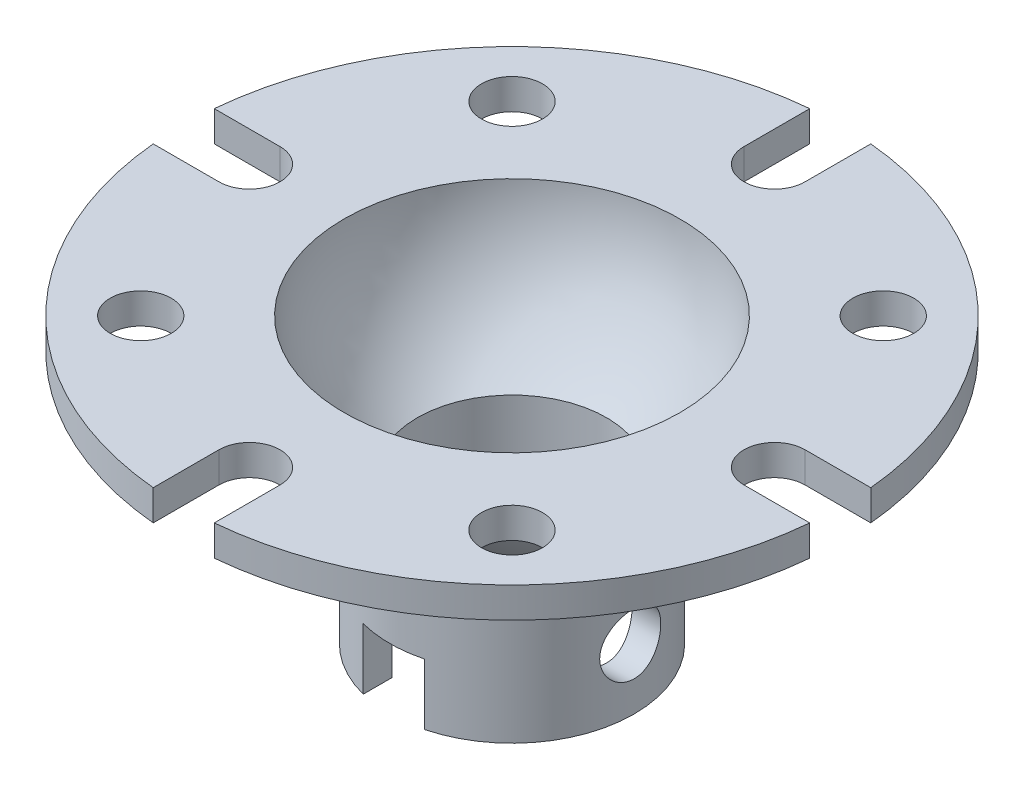
from build123d import *

# Parameters (mm, degrees)
SCHIZZO2_R                           = 10
TAGLIO_ESTRUSIONE2_DEPTH             = 10
RIPETIZIONECIRCOLARE2_COUNT          = 4
TAGLIO_ESTRUSIONE3_REACH             = 180.261
SCHIZZO4_R                           = 10
TAGLIO_ESTRUSIONE3_DIRECTION_2_REACH = 180.261
TAGLIO_ESTRUSIONE4_REACH             = 180.261
SCHIZZO5_W                           = 20
SCHIZZO5_H                           = 20
TAGLIO_ESTRUSIONE4_DIRECTION_2_REACH = 180.261


with BuildPart() as part:
    # Schizzo1 → Rivoluzione1 (revolve)
    with BuildSketch(Plane.XY, mode=Mode.PRIVATE) as rivoluzione1_sk:
        with BuildLine():
            Line((31, 0), (40, 0))
            Line((40, 0), (40, 45))
            ThreePointArc((40, 45), (55.192640723, 61.901498667), (63.638363359, 83))
            Line((63.638363359, 83), (108, 83))
            Line((108, 83), (108, 93))
            Line((108, 93), (55, 93))
            ThreePointArc((55, 93), (48.182091863, 67.998869263), (31, 48.6))
            Line((31, 48.6), (31, 0))
        make_face()
    revolve(rivoluzione1_sk.sketch.rotate(Axis((0, 136.24893985, 0), (0, -1, 0)), 180), axis=Axis((0, 136.24893985, 0), (0, -1, 0)))

    # Schizzo2 → Taglio-Estrusione2 (cut)
    with BuildSketch(Plane(origin=(0, 93, 0), x_dir=(1, 0, 0), z_dir=(0, 1, 0))):
        with Locations(Location((60.811183182, 60.811183182, 0), (0, 0, 180))):
            Circle(SCHIZZO2_R)
        with BuildLine():
            Line((107.53604047, 10), (86, 10))
            ThreePointArc((86, 10), (76, 0), (86, -10))
            Line((86, -10), (107.53604047, -10))
            ThreePointArc((107.53604047, -10), (108, 0), (107.53604047, 10))
        make_face()
    taglio_estrusione2 = extrude(amount=-TAGLIO_ESTRUSIONE2_DEPTH, mode=Mode.SUBTRACT)

    # RipetizioneCircolare2: Taglio-Estrusione2 ×4 about axis
    ripetizionecircolare2_axis = Axis((0, 0, 0), (0, 1, 0))
    for i in range(1, RIPETIZIONECIRCOLARE2_COUNT):
        add(taglio_estrusione2.rotate(ripetizionecircolare2_axis, i * 360 / RIPETIZIONECIRCOLARE2_COUNT), mode=Mode.SUBTRACT)

    # Schizzo4 → Taglio-Estrusione3 (cut, up to next)
    with BuildSketch(Plane(origin=(0, 0, 0), x_dir=(0, 0, -1), z_dir=(1, 0, 0)), mode=Mode.PRIVATE) as taglio_estrusione3_sk1:
        with Locations((0, 20)):
            Circle(SCHIZZO4_R)
    taglio_estrusione3_tool1 = extrude(taglio_estrusione3_sk1.sketch, amount=-TAGLIO_ESTRUSIONE3_REACH, mode=Mode.PRIVATE) & part.part
    add(taglio_estrusione3_tool1.solids().sort_by_distance((0, 20, 0))[0], mode=Mode.SUBTRACT)

    # Schizzo4 → Taglio-Estrusione3 direction 2 (cut, up to next)
    with BuildSketch(Plane(origin=(0, 0, 0), x_dir=(0, 0, -1), z_dir=(1, 0, 0)), mode=Mode.PRIVATE) as taglio_estrusione3_direction_2_sk1:
        with Locations((0, 20)):
            Circle(SCHIZZO4_R)
    taglio_estrusione3_direction_2_tool1 = extrude(taglio_estrusione3_direction_2_sk1.sketch, amount=TAGLIO_ESTRUSIONE3_DIRECTION_2_REACH, mode=Mode.PRIVATE) & part.part
    add(taglio_estrusione3_direction_2_tool1.solids().sort_by_distance((0, 20, 0))[0], mode=Mode.SUBTRACT)

    # Schizzo5 → Taglio-Estrusione4 (cut, up to next)
    with BuildSketch(Plane.XY, mode=Mode.PRIVATE) as taglio_estrusione4_sk1:
        with Locations((0, 10)):
            Rectangle(SCHIZZO5_W, SCHIZZO5_H)
    taglio_estrusione4_tool1 = extrude(taglio_estrusione4_sk1.sketch, amount=-TAGLIO_ESTRUSIONE4_REACH, mode=Mode.PRIVATE) & part.part
    add(taglio_estrusione4_tool1.solids().sort_by_distance((0, 10, 0))[0], mode=Mode.SUBTRACT)

    # Schizzo5 → Taglio-Estrusione4 direction 2 (cut, up to next)
    with BuildSketch(Plane.XY, mode=Mode.PRIVATE) as taglio_estrusione4_direction_2_sk1:
        with Locations((0, 10)):
            Rectangle(SCHIZZO5_W, SCHIZZO5_H)
    taglio_estrusione4_direction_2_tool1 = extrude(taglio_estrusione4_direction_2_sk1.sketch, amount=TAGLIO_ESTRUSIONE4_DIRECTION_2_REACH, mode=Mode.PRIVATE) & part.part
    add(taglio_estrusione4_direction_2_tool1.solids().sort_by_distance((0, 10, 0))[0], mode=Mode.SUBTRACT)


solid = part.part
